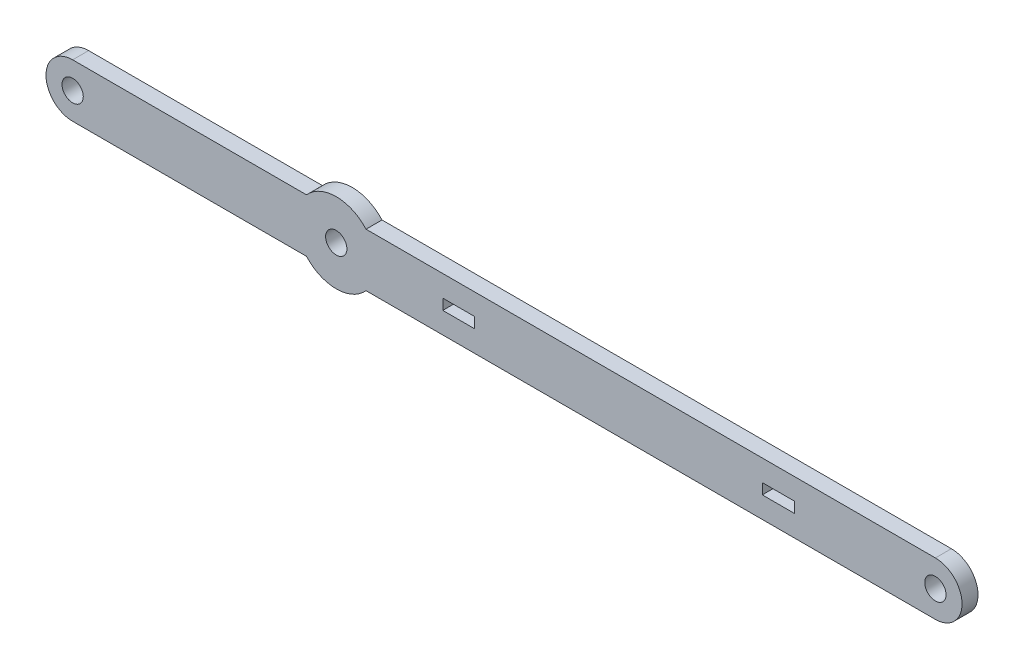
from build123d import *

# Parameters (mm, degrees)
SKETCH_3_R      = 2
SKETCH_3_W      = 6
SKETCH_3_H      = 2
EXTRUDE_1_DEPTH = 1.5


with BuildPart() as part:
    # 草图3 → 凸台-拉伸1 (new, symmetric)
    with BuildSketch(Plane.XY):
        with BuildLine():
            Line((0, 5), (43.909830056, 5))
            ThreePointArc((43.909830056, 5), (49.5, 7.5), (55.090169944, 5))
            Line((55.090169944, 5), (162, 5))
            ThreePointArc((162, 5), (167, 0), (162, -5))
            Line((162, -5), (55.090169944, -5))
            ThreePointArc((55.090169944, -5), (49.5, -7.5), (43.909830056, -5))
            Line((43.909830056, -5), (0, -5))
            ThreePointArc((0, -5), (-5, 0), (0, 5))
        make_face()
        with Locations((162, 0)):
            Circle(SKETCH_3_R, mode=Mode.SUBTRACT)
        Circle(SKETCH_3_R, mode=Mode.SUBTRACT)
        with Locations((49.5, 0)):
            Circle(SKETCH_3_R, mode=Mode.SUBTRACT)
        with Locations((72.5, 0)):
            Rectangle(SKETCH_3_W, SKETCH_3_H, mode=Mode.SUBTRACT)
        with Locations((132.5, 0)):
            Rectangle(SKETCH_3_W, SKETCH_3_H, mode=Mode.SUBTRACT)
    extrude(amount=EXTRUDE_1_DEPTH, both=True)


solid = part.part
